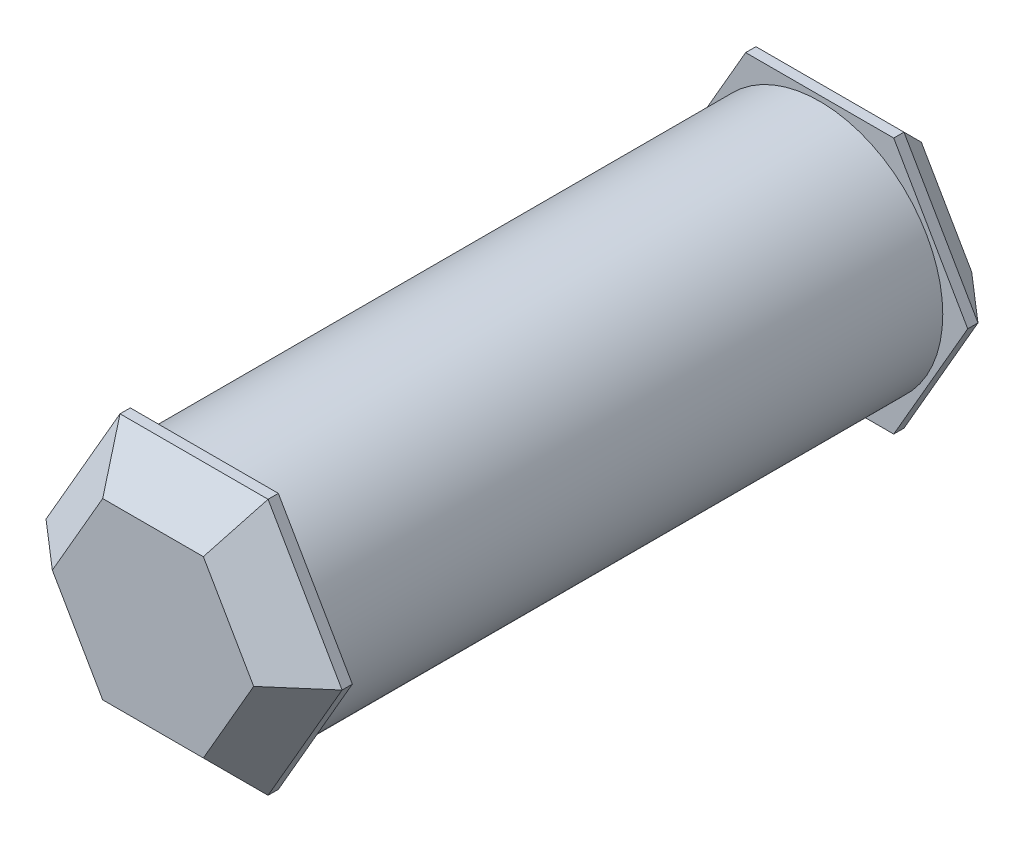
from build123d import *

# Parameters (mm, degrees)
CROQUIS1_R              = 1.2
SALIENTE_EXTRUIR1_DEPTH = 6
SALIENTE_EXTRUIR2_DEPTH = 0.5
SALIENTE_EXTRUIR3_DEPTH = 0.5
CHAFL_N1_SIZE           = 0.4
CHAFL_N2_SIZE           = 0.4
CHAFL_N3_SIZE           = 0.4
CHAFL_N4_SIZE           = 0.4
CHAFL_N5_SIZE           = 0.4
CHAFL_N6_SIZE           = 0.4
CHAFL_N7_SIZE           = 0.4
CHAFL_N8_SIZE           = 0.4
CHAFL_N9_SIZE           = 0.4
CHAFL_N10_SIZE          = 0.4
CHAFL_N11_SIZE          = 0.4
CHAFL_N12_SIZE          = 0.4


with BuildPart() as part:
    # Croquis1 → Saliente-Extruir1 (new body)
    with BuildSketch(Plane.XY):
        Circle(CROQUIS1_R)
    extrude(amount=SALIENTE_EXTRUIR1_DEPTH)

    # Croquis2 → Saliente-Extruir2 (add)
    with BuildSketch(Plane.XY.offset(6)):
        Polygon((1.443375673, 0), (0.721687836, 1.25), (-0.721687836, 1.25), (-1.443375673, 0), (-0.721687836, -1.25), (0.721687836, -1.25), align=None)
    extrude(amount=SALIENTE_EXTRUIR2_DEPTH)

    # Croquis3 → Saliente-Extruir3 (add)
    with BuildSketch(Plane(origin=(0, 0, 0), x_dir=(-1, 0, 0), z_dir=(0, 0, -1))):
        Polygon((1.443375673, 0), (0.721687836, 1.25), (-0.721687836, 1.25), (-1.443375673, 0), (-0.721687836, -1.25), (0.721687836, -1.25), align=None)
    extrude(amount=SALIENTE_EXTRUIR3_DEPTH)

    # Chaflán1
    chafl_n1_edges = [part.edges().sort_by_distance(p)[0] for p in [
        (0, 1.25, 6.5),
    ]]
    chamfer(chafl_n1_edges, length=CHAFL_N1_SIZE)

    # Chaflán2
    chafl_n2_edges = [part.edges().sort_by_distance(p)[0] for p in [
        (1.198001809, 0.425, 6.5),
    ]]
    chamfer(chafl_n2_edges, length=CHAFL_N2_SIZE)

    # Chaflán3
    chafl_n3_edges = [part.edges().sort_by_distance(p)[0] for p in [
        (0.967061701, -0.825, 6.5),
    ]]
    chamfer(chafl_n3_edges, length=CHAFL_N3_SIZE)

    # Chaflán4
    chafl_n4_edges = [part.edges().sort_by_distance(p)[0] for p in [
        (-0.230940108, -1.25, 6.5),
    ]]
    chamfer(chafl_n4_edges, length=CHAFL_N4_SIZE)

    # Chaflán5
    chafl_n5_edges = [part.edges().sort_by_distance(p)[0] for p in [
        (-1.198001809, -0.425, 6.5),
    ]]
    chamfer(chafl_n5_edges, length=CHAFL_N5_SIZE)

    # Chaflán6
    chafl_n6_edges = [part.edges().sort_by_distance(p)[0] for p in [
        (-1.082531755, 0.625, 6.5),
    ]]
    chamfer(chafl_n6_edges, length=CHAFL_N6_SIZE)

    # Chaflán7
    chafl_n7_edges = [part.edges().sort_by_distance(p)[0] for p in [
        (1.082531755, -0.625, -0.5),
    ]]
    chamfer(chafl_n7_edges, length=CHAFL_N7_SIZE)

    # Chaflán8
    chafl_n8_edges = [part.edges().sort_by_distance(p)[0] for p in [
        (0.967061701, 0.825, -0.5),
    ]]
    chamfer(chafl_n8_edges, length=CHAFL_N8_SIZE)

    # Chaflán9
    chafl_n9_edges = [part.edges().sort_by_distance(p)[0] for p in [
        (-0.230940108, 1.25, -0.5),
    ]]
    chamfer(chafl_n9_edges, length=CHAFL_N9_SIZE)

    # Chaflán10
    chafl_n10_edges = [part.edges().sort_by_distance(p)[0] for p in [
        (-0.230940108, -1.25, -0.5),
    ]]
    chamfer(chafl_n10_edges, length=CHAFL_N10_SIZE)

    # Chaflán11
    chafl_n11_edges = [part.edges().sort_by_distance(p)[0] for p in [
        (-1.198001809, -0.425, -0.5),
    ]]
    chamfer(chafl_n11_edges, length=CHAFL_N11_SIZE)

    # Chaflán12
    chafl_n12_edges = [part.edges().sort_by_distance(p)[0] for p in [
        (-1.082531755, 0.625, -0.5),
    ]]
    chamfer(chafl_n12_edges, length=CHAFL_N12_SIZE)


solid = part.part
